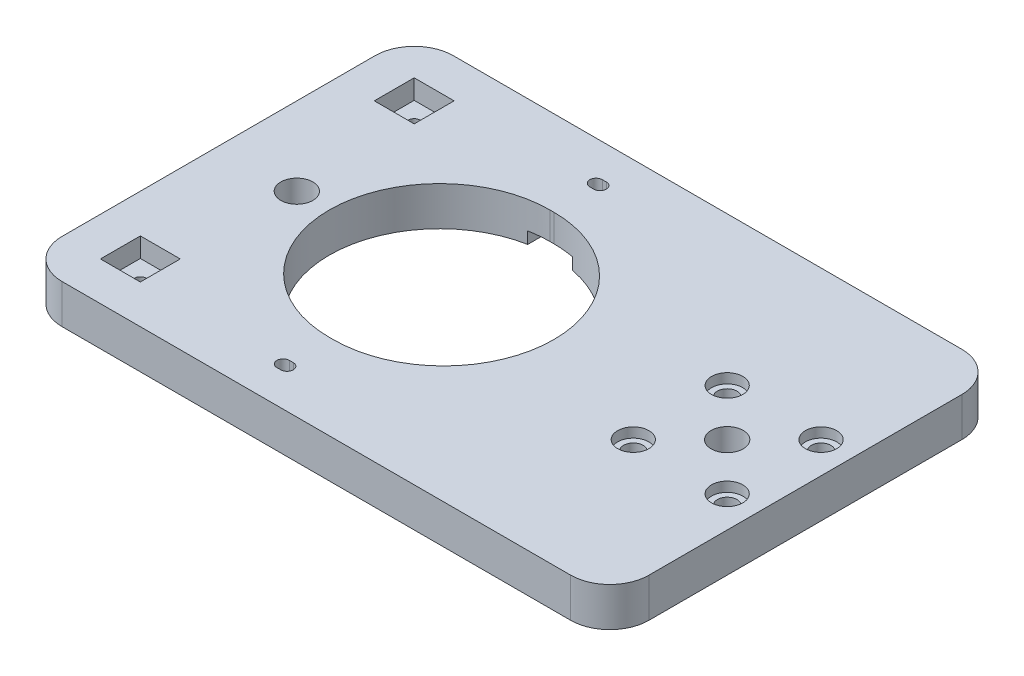
from build123d import *

# Parameters (mm, degrees)
SKETCH_1_R          = 4.1
SKETCH_1_R_2        = 2.5
EXTRUDE_1_DEPTH     = 10
CUT_EXTRUDE_3_REACH = 92.692
CUT_EXTRUDE_START   = 3
CUT_EXTRUDE_4_DEPTH = 3
SKETCH_7_R          = 5.1
CUT_EXTRUDE_5_DEPTH = 5
SKETCH_8_R          = 4
CUT_EXTRUDE_6_DEPTH = 2.5
SKETCH_9_R          = 1.5
CUT_EXTRUDE_7_DEPTH = 91.691785736
SKETCH_10_W         = 10.2
SKETCH_10_H         = 10.2
CUT_EXTRUDE_8_DEPTH = 5


with BuildPart() as part:
    # ｽｹｯﾁ1 → ﾎﾞｽ - 押し出し1 (new body)
    with BuildSketch(Plane(origin=(0, 0, 0), x_dir=(1, 0, 0), z_dir=(0, 1, 0))):
        with BuildLine():
            Line((-65, -50), (65, -50))
            ThreePointArc((65, -50), (72.071067812, -47.071067812), (75, -40))
            Line((75, -40), (75, 40))
            ThreePointArc((75, 40), (72.071067812, 47.071067812), (65, 50))
            Line((65, 50), (-65, 50))
            ThreePointArc((-65, 50), (-72.071067812, 47.071067812), (-75, 40))
            Line((-75, 40), (-75, -40))
            ThreePointArc((-75, -40), (-72.071067812, -47.071067812), (-65, -50))
        make_face()
        with Locations(Location((55, 0, 0), (0, 0, 270))):
            Circle(SKETCH_1_R, mode=Mode.SUBTRACT)
        with Locations(Location((43, 12, 0), (0, 0, 270))):
            Circle(SKETCH_1_R_2, mode=Mode.SUBTRACT)
        with Locations(Location((67, 12, 0), (0, 0, 270))):
            Circle(SKETCH_1_R_2, mode=Mode.SUBTRACT)
        with Locations(Location((67, -12, 0), (0, 0, 270))):
            Circle(SKETCH_1_R_2, mode=Mode.SUBTRACT)
        with Locations(Location((43, -12, 0), (0, 0, 270))):
            Circle(SKETCH_1_R_2, mode=Mode.SUBTRACT)
        with Locations(Location((-55, 0, 0), (0, 0, 270))):
            Circle(SKETCH_1_R, mode=Mode.SUBTRACT)
    extrude(amount=EXTRUDE_1_DEPTH)

    # ｽｹｯﾁ5 → ｶｯﾄ - 押し出し3 (cut, up to next)
    with BuildSketch(Plane(origin=(0, 10, 0), x_dir=(1, 0, 0), z_dir=(0, 1, 0)), mode=Mode.PRIVATE) as cut_extrude_3_sk1:
        with BuildLine():
            Line((-18.5, 28.2), (-17.5, 28.2))
            ThreePointArc((-17.5, 28.2), (10.7, 0), (-17.5, -28.2))
            Line((-17.5, -28.2), (-18.5, -28.2))
            ThreePointArc((-18.5, -28.2), (-46.7, 0), (-18.5, 28.2))
        make_face()
    cut_extrude_3_tool1 = extrude(cut_extrude_3_sk1.sketch, amount=-CUT_EXTRUDE_3_REACH, mode=Mode.PRIVATE) & part.part
    # ｽｹｯﾁ5 → ｶｯﾄ - 押し出し3 (cut, up to next)
    with BuildSketch(Plane(origin=(0, 10, 0), x_dir=(1, 0, 0), z_dir=(0, 1, 0)), mode=Mode.PRIVATE) as cut_extrude_3_sk2:
        with BuildLine():
            Line((-18.5, 41.6), (-17.5, 41.6))
            ThreePointArc((-17.5, 41.6), (-15.9, 40), (-17.5, 38.4))
            Line((-17.5, 38.4), (-18.5, 38.4))
            ThreePointArc((-18.5, 38.4), (-20.1, 40), (-18.5, 41.6))
        make_face()
    cut_extrude_3_tool2 = extrude(cut_extrude_3_sk2.sketch, amount=-CUT_EXTRUDE_3_REACH, mode=Mode.PRIVATE) & part.part
    # ｽｹｯﾁ5 → ｶｯﾄ - 押し出し3 (cut, up to next)
    with BuildSketch(Plane(origin=(0, 10, 0), x_dir=(1, 0, 0), z_dir=(0, 1, 0)), mode=Mode.PRIVATE) as cut_extrude_3_sk3:
        with BuildLine():
            Line((-18.5, -38.4), (-17.5, -38.4))
            ThreePointArc((-17.5, -38.4), (-15.9, -40), (-17.5, -41.6))
            Line((-17.5, -41.6), (-18.5, -41.6))
            ThreePointArc((-18.5, -41.6), (-20.1, -40), (-18.5, -38.4))
        make_face()
    cut_extrude_3_tool3 = extrude(cut_extrude_3_sk3.sketch, amount=-CUT_EXTRUDE_3_REACH, mode=Mode.PRIVATE) & part.part
    add(cut_extrude_3_tool1.solids().sort_by_distance((-18, 10, 0))[0], mode=Mode.SUBTRACT)
    add(cut_extrude_3_tool2.solids().sort_by_distance((-18, 10, -40))[0], mode=Mode.SUBTRACT)
    add(cut_extrude_3_tool3.solids().sort_by_distance((-18, 10, 40))[0], mode=Mode.SUBTRACT)

    # ｽｹｯﾁ6 → ｶｯﾄ - 押し出し4 (cut)
    with BuildSketch(Plane(origin=(0, 0, 0), x_dir=(1, 0, 0), z_dir=(0, 1, 0)).offset(CUT_EXTRUDE_START)):
        with BuildLine():
            Line((-18.5, 45.2), (-17.5, 45.2))
            ThreePointArc((-17.5, 45.2), (-13.823044738, 43.676955262), (-12.3, 40))
            Line((-12.3, 40), (-12.3, 27.716421125))
            ThreePointArc((-12.3, 27.716421125), (10.7, 0), (-12.3, -27.716421125))
            Line((-12.3, -27.716421125), (-12.3, -40))
            ThreePointArc((-12.3, -40), (-13.823044738, -43.676955262), (-17.5, -45.2))
            Line((-17.5, -45.2), (-18.5, -45.2))
            ThreePointArc((-18.5, -45.2), (-22.176955262, -43.676955262), (-23.7, -40))
            Line((-23.7, -40), (-23.7, -27.716421125))
            ThreePointArc((-23.7, -27.716421125), (-46.7, 0), (-23.7, 27.716421125))
            Line((-23.7, 27.716421125), (-23.7, 40))
            ThreePointArc((-23.7, 40), (-22.176955262, 43.676955262), (-18.5, 45.2))
        make_face()
    extrude(amount=-CUT_EXTRUDE_4_DEPTH, mode=Mode.SUBTRACT)

    # ｽｹｯﾁ7 → ｶｯﾄ - 押し出し5 (cut)
    with BuildSketch(Plane.XZ):
        with Locations(Location((20, 0, 0), (0, 0, 270))):
            Circle(SKETCH_7_R)
    extrude(amount=-CUT_EXTRUDE_5_DEPTH, mode=Mode.SUBTRACT)

    # ｽｹｯﾁ8 → ｶｯﾄ - 押し出し6 (cut)
    with BuildSketch(Plane(origin=(0, 10, 0), x_dir=(1, 0, 0), z_dir=(0, 1, 0))):
        with Locations(Location((43, 12, 0), (0, 0, 270))):
            Circle(SKETCH_8_R)
        with Locations(Location((67, 12, 0), (0, 0, 270))):
            Circle(SKETCH_8_R)
        with Locations(Location((43, -12, 0), (0, 0, 270))):
            Circle(SKETCH_8_R)
        with Locations(Location((67, -12, 0), (0, 0, 270))):
            Circle(SKETCH_8_R)
    extrude(amount=-CUT_EXTRUDE_6_DEPTH, mode=Mode.SUBTRACT)

    # ｽｹｯﾁ9 → ｶｯﾄ - 押し出し7 (cut, through all)
    with BuildSketch(Plane(origin=(0, 10, 0), x_dir=(1, 0, 0), z_dir=(0, 1, 0))):
        with Locations(Location((-60, 35, 0), (0, 0, 270))):
            Circle(SKETCH_9_R)
        with Locations(Location((-60, -35, 0), (0, 0, 270))):
            Circle(SKETCH_9_R)
    extrude(amount=-CUT_EXTRUDE_7_DEPTH, mode=Mode.SUBTRACT)

    # ｽｹｯﾁ10 → ｶｯﾄ - 押し出し8 (cut)
    with BuildSketch(Plane(origin=(0, 10, 0), x_dir=(1, 0, 0), z_dir=(0, 1, 0))):
        with Locations((-60, 35)):
            Rectangle(SKETCH_10_W, SKETCH_10_H)
        with Locations((-60, -35)):
            Rectangle(SKETCH_10_W, SKETCH_10_H)
    extrude(amount=-CUT_EXTRUDE_8_DEPTH, mode=Mode.SUBTRACT)


solid = part.part
